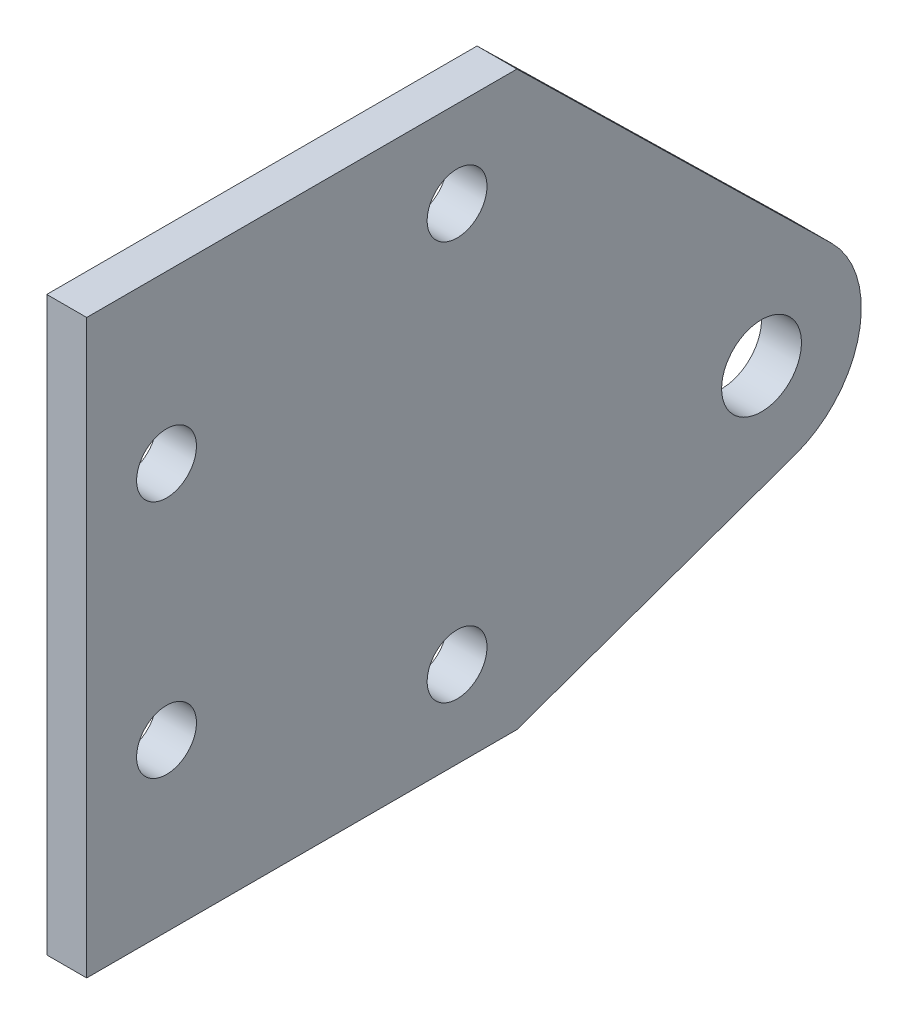
from build123d import *

# Parameters (mm, degrees)
SKETCH1_R           = 3.175
SKETCH1_R_2         = 3.2639
SKETCH1_R_3         = 3.96875
SKETCH1_R_4         = 2.38125
BOSS_EXTRUDE1_DEPTH = 3.175


with BuildPart() as part:
    # Sketch1 → Boss-Extrude1 (new body)
    # profile 1 of 7: a face of its own
    with BuildSketch(Plane.ZY.offset(25.4)):
        with BuildLine():
            Line((-88.4975, 379.360683619), (-113.503995941, 354.868900976))
            ThreePointArc((-113.503995941, 354.868900976), (-115.701762144, 347.491113055), (-110.608164688, 341.71900808))
            Line((-110.608164688, 341.71900808), (-88.4975, 333.860683619))
            Line((-88.4975, 333.860683619), (-102.195874596, 351.845168269))
            ThreePointArc((-102.195874596, 351.845168269), (-103.980307482, 357.263971701), (-102.037425504, 362.628003857))
            Line((-102.037425504, 362.628003857), (-88.4975, 379.360683619))
        make_face()
        with Locations((-107.95, 349.198183619)):
            Circle(SKETCH1_R, mode=Mode.SUBTRACT)
    # profile 2 of 7: a face of its own
    with BuildSketch(Plane.ZY.offset(25.4)):
        with BuildLine():
            Line((-54.275, 333.860683619), (-54.275, 379.360683619))
            Line((-54.275, 379.360683619), (-88.4975, 379.360683619))
            Line((-88.4975, 379.360683619), (-102.037425504, 362.628003857))
            ThreePointArc((-102.037425504, 362.628003857), (-103.980307482, 357.263971701), (-102.195874596, 351.845168269))
            Line((-102.195874596, 351.845168269), (-88.4975, 333.860683619))
            Line((-88.4975, 333.860683619), (-54.275, 333.860683619))
        make_face()
        with Locations((-83.735, 340.735683619)):
            Circle(SKETCH1_R_2, mode=Mode.SUBTRACT)
        with Locations((-95.25, 357.135683619)):
            Circle(SKETCH1_R_3, mode=Mode.SUBTRACT)
        with Locations((-60.625, 366.135683619)):
            Circle(SKETCH1_R_2, mode=Mode.SUBTRACT)
        with Locations((-83.735, 372.485683619)):
            Circle(SKETCH1_R_2, mode=Mode.SUBTRACT)
        with Locations((-60.625, 347.085683619)):
            Circle(SKETCH1_R_2, mode=Mode.SUBTRACT)
    # profile 3 of 7: a face of its own
    with BuildSketch(Plane.ZY.offset(25.4)):
        with Locations((-95.25, 357.135683619)):
            Circle(SKETCH1_R_3)
    # profile 4 of 7: a face of its own
    with BuildSketch(Plane.ZY.offset(25.4)):
        with Locations((-60.625, 366.135683619)):
            Circle(SKETCH1_R_2)
        with Locations((-60.625, 366.135683619)):
            Circle(SKETCH1_R_4, mode=Mode.SUBTRACT)
    # profile 5 of 7: a face of its own
    with BuildSketch(Plane.ZY.offset(25.4)):
        with Locations((-83.735, 372.485683619)):
            Circle(SKETCH1_R_2)
        with Locations((-83.735, 372.485683619)):
            Circle(SKETCH1_R_4, mode=Mode.SUBTRACT)
    # profile 6 of 7: a face of its own
    with BuildSketch(Plane.ZY.offset(25.4)):
        with Locations((-60.625, 347.085683619)):
            Circle(SKETCH1_R_2)
        with Locations((-60.625, 347.085683619)):
            Circle(SKETCH1_R_4, mode=Mode.SUBTRACT)
    # profile 7 of 7: a face of its own
    with BuildSketch(Plane.ZY.offset(25.4)):
        with Locations((-83.735, 340.735683619)):
            Circle(SKETCH1_R_2)
        with Locations((-83.735, 340.735683619)):
            Circle(SKETCH1_R_4, mode=Mode.SUBTRACT)
    extrude(amount=BOSS_EXTRUDE1_DEPTH)


solid = part.part
